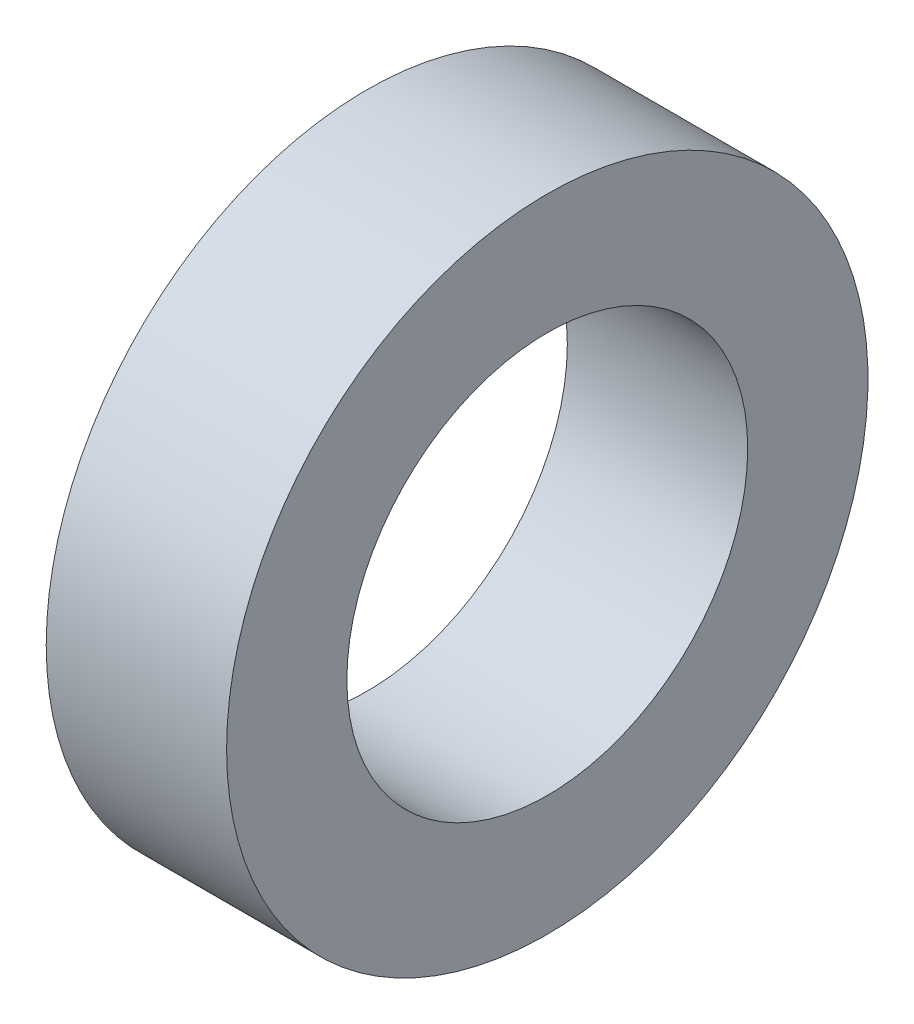
from build123d import *

# Parameters (mm, degrees)
SKETCH_1_W = 4.5
SKETCH_1_H = 3


with BuildPart() as part:
    # Эскиз1 → Повернуть1 (revolve)
    with BuildSketch(Plane.XY, mode=Mode.PRIVATE) as revolve_1_sk:
        with Locations((-5.177811861, 13.35593047)):
            Rectangle(SKETCH_1_W, SKETCH_1_H)
    revolve(revolve_1_sk.sketch.rotate(Axis((-51.708997955, 6.85593047, 0), (1, 0, 0)), 90), axis=Axis((-51.708997955, 6.85593047, 0), (1, 0, 0)))


solid = part.part
